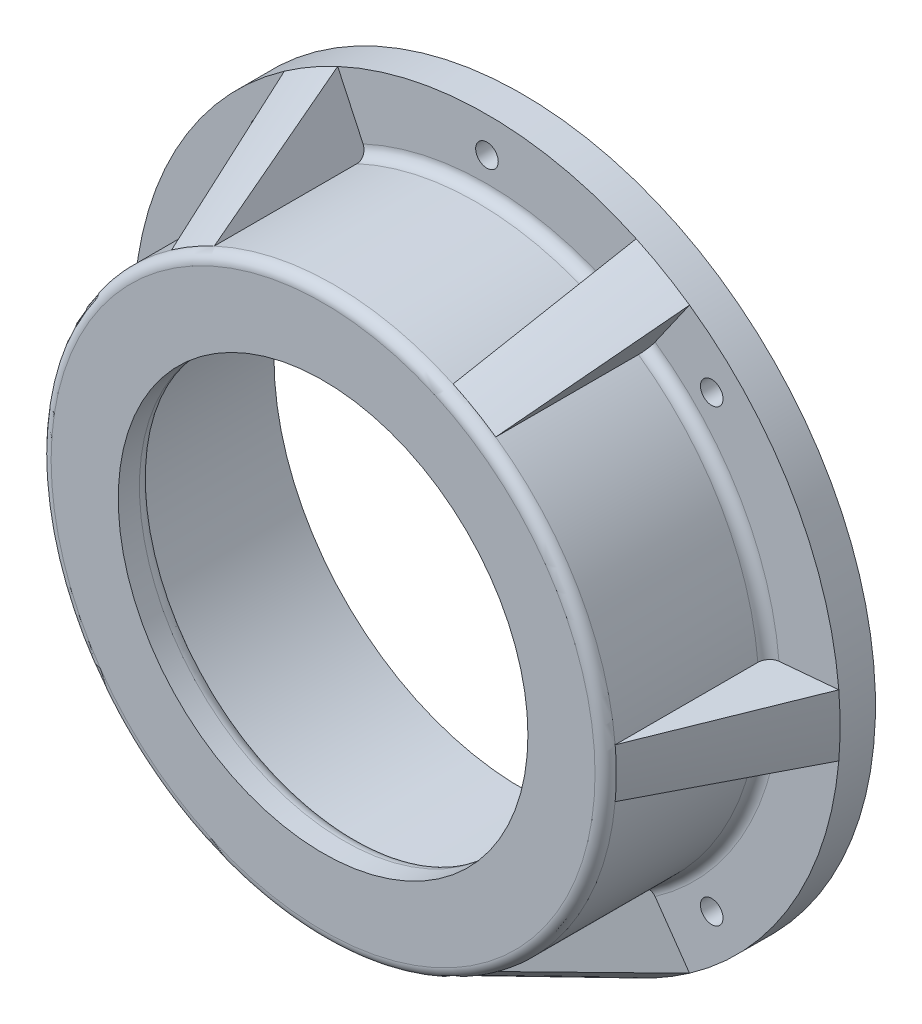
from build123d import *

# Parameters (mm, degrees)
SKETCH_1_R               = 40
SKETCH_1_R_2             = 35.15
EXTRUDE_1_DEPTH          = 28.2
SKETCH_2_R               = 35.5
SKETCH_2_R_2             = 29
EXTRUDE_2_DEPTH          = 5
SKETCH_3_R               = 50
SKETCH_3_R_2             = 40
EXTRUDE_3_DEPTH          = 5
SKETCH_4_R               = 1.6
CUT_EXTRUDE_1_DEPTH      = 75.419352322
FILLET_1_R               = 1.5
FILLET_2_R               = 2
REVOLVE_1_ANGLE          = 10
PATTERN_CIRCULAR_1_COUNT = 6
FILLET_3_R               = 1.5


with BuildPart() as part:
    # 草图1 → 凸台-拉伸1 (new body)
    with BuildSketch(Plane.XY):
        Circle(SKETCH_1_R)
        Circle(SKETCH_1_R_2, mode=Mode.SUBTRACT)
    extrude(amount=EXTRUDE_1_DEPTH)

    # 草图2 → 凸台-拉伸2 (add)
    with BuildSketch(Plane.XY.offset(28.2)):
        Circle(SKETCH_2_R)
        Circle(SKETCH_2_R_2, mode=Mode.SUBTRACT)
    extrude(amount=-EXTRUDE_2_DEPTH)

    # 草图3 → 凸台-拉伸3 (add)
    with BuildSketch(Plane(origin=(0, 0, 0), x_dir=(-1, 0, 0), z_dir=(0, 0, -1))):
        Circle(SKETCH_3_R)
        Circle(SKETCH_3_R_2, mode=Mode.SUBTRACT)
    extrude(amount=-EXTRUDE_3_DEPTH)

    # 草图4 → 切除-拉伸1 (cut, through all)
    with BuildSketch(Plane.XY.offset(5)):
        with Locations((31.819805153, 31.819805153)):
            Circle(SKETCH_4_R)
        with Locations((31.819805153, -31.819805153)):
            Circle(SKETCH_4_R)
        with Locations((-31.819805153, -31.819805153)):
            Circle(SKETCH_4_R)
        with Locations((-31.819805153, 31.819805153)):
            Circle(SKETCH_4_R)
        with Locations((0, 45)):
            Circle(SKETCH_4_R)
        with Locations((0, -45)):
            Circle(SKETCH_4_R)
    extrude(amount=-CUT_EXTRUDE_1_DEPTH, mode=Mode.SUBTRACT)

    # 圆角1
    fillet_1_edges = [part.edges().sort_by_distance(p)[0] for p in [
        (-35.15, 0, 23.2),
        (-40, 0, 28.2),
    ]]
    fillet(fillet_1_edges, radius=FILLET_1_R)

    # 圆角2
    fillet_2_edges = [part.edges().sort_by_distance(p)[0] for p in [
        (-29, 0, 23.2),
    ]]
    fillet(fillet_2_edges, radius=FILLET_2_R)

    # 草图5 → 旋转1 (revolve, symmetric)
    with BuildSketch(Plane(origin=(0, 0, 0), x_dir=(1, 0, 0), z_dir=(0, 1, 0))) as revolve_1_sk:
        Polygon((-50, -5), (-40, -26.7), (-40, -5), align=None)
    revolve_1 = revolve(axis=Axis((0, 0, -1.41), (0, 0, 1)), revolution_arc=REVOLVE_1_ANGLE / 2)
    revolve_1 = revolve_1 + revolve(revolve_1_sk.sketch, axis=Axis((0, 0, -1.41), (0, 0, -1)), revolution_arc=REVOLVE_1_ANGLE / 2)

    # 阵列(圆周)1: 旋转1 ×6 about axis
    pattern_circular_1_axis = Axis((0, 0, 0), (0, 0, 1))
    for i in range(1, PATTERN_CIRCULAR_1_COUNT):
        add(revolve_1.rotate(pattern_circular_1_axis, i * 360 / PATTERN_CIRCULAR_1_COUNT))

    # 圆角3
    fillet_3_edges = [part.edges().sort_by_distance(p)[0] for p in [
        (34.641016151, 20, 5),
        (0, 40, 5),
        (-34.641016151, 20, 5),
        (-34.641016151, -20, 5),
        (0, -40, 5),
        (34.641016151, -20, 5),
    ]]
    fillet(fillet_3_edges, radius=FILLET_3_R)


solid = part.part
